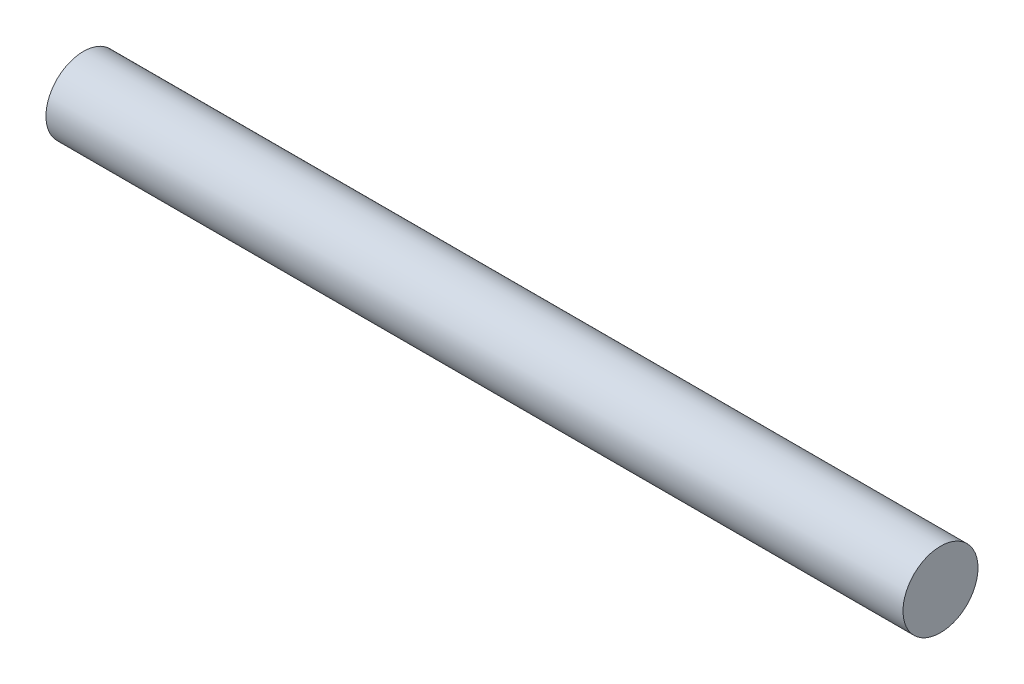
from build123d import *

# Parameters (mm, degrees)
SKETCH1_R           = 3.5
BOSS_EXTRUDE1_DEPTH = 80


with BuildPart() as part:
    # Sketch1 → Boss-Extrude1 (new body)
    with BuildSketch(Plane(origin=(0, 0, 0), x_dir=(0, 0, -1), z_dir=(1, 0, 0))):
        Circle(SKETCH1_R)
    extrude(amount=BOSS_EXTRUDE1_DEPTH)


solid = part.part
